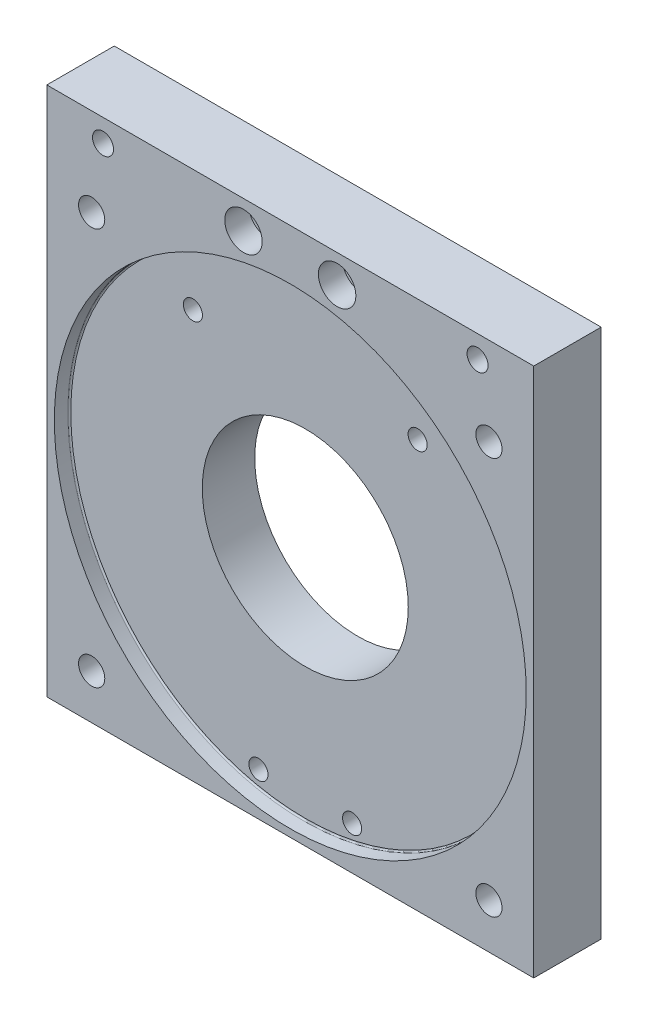
from build123d import *

# Parameters (mm, degrees)
BOSS_EXTRUDE1_DEPTH                                  = 50.8
SKETCH6_W                                            = 7.4
SKETCH6_H                                            = 283
CUT_EXTRUDE3_DEPTH                                   = 306.924238987
SKETCH2_R                                            = 126
CUT_EXTRUDE1_DEPTH                                   = 8
M16_TAPPED_HOLE1_D                                   = 14
SKETCH5_R                                            = 55
CUT_EXTRUDE2_DEPTH                                   = 203.714084365
FILLET1_R                                            = 0.79375
CBORE_FOR_M12_HEX_SOCKET_HEAD_CAP_SCREW1_D           = 13.5
CBORE_FOR_M12_HEX_SOCKET_HEAD_CAP_SCREW1_CBORE_D     = 20
CBORE_FOR_M12_HEX_SOCKET_HEAD_CAP_SCREW1_CBORE_DEPTH = 13
M12_TAPPED_HOLE1_D                                   = 10.2
M6_TAPPED_HOLE1_D                                    = 5
M6_TAPPED_HOLE1_DEPTH                                = 27.99
M6_TAPPED_HOLE1_TIP                                  = 1.502151548
F_11_2_11_2_DIAMETER_HOLE1_D                         = 11.2
F_11_2_11_2_DIAMETER_HOLE1_DEPTH                     = 20
F_11_2_11_2_DIAMETER_HOLE1_TIP                       = 3.364819467


with BuildPart() as part:
    # Sketch1 → Boss-Extrude1 (new body)
    with BuildSketch(Plane.XY):
        Polygon((-130, 130), (-130, -130), (130, -130), (130, 130), (130, 153), (-130, 153), align=None)
    extrude(amount=BOSS_EXTRUDE1_DEPTH)

    # Sketch6 → Cut-Extrude3 (cut, through all)
    with BuildSketch(Plane(origin=(130, 0, 0), x_dir=(0, 0, -1), z_dir=(1, 0, 0))):
        with Locations((-3.7, 11.5)):
            Rectangle(SKETCH6_W, SKETCH6_H)
        with Locations((-47.1, 11.5)):
            Rectangle(SKETCH6_W, SKETCH6_H)
    extrude(amount=-CUT_EXTRUDE3_DEPTH, mode=Mode.SUBTRACT)

    # Sketch2 → Cut-Extrude1 (cut)
    with BuildSketch(Plane.XY.offset(43.4)):
        Circle(SKETCH2_R)
    extrude(amount=-CUT_EXTRUDE1_DEPTH, mode=Mode.SUBTRACT)

    # M16 Tapped Hole1 (through all)
    with Locations(Plane(origin=(116.1053078, 120.483553204, 43.4), x_dir=(1, 0, 0), z_dir=(0, 0, 1))):
        with Locations((-222.171324978, -14.417536026), (-10.039290622, -14.417536026), (-10.039290622, -226.549570382), (-222.171324978, -226.549570382)):
            Hole(M16_TAPPED_HOLE1_D / 2)

    # Sketch5 → Cut-Extrude2 (cut, through all)
    with BuildSketch(Plane.XY.offset(35.4)):
        Circle(SKETCH5_R)
    extrude(amount=-CUT_EXTRUDE2_DEPTH, mode=Mode.SUBTRACT)

    # Fillet1
    fillet1_edges = [part.edges().sort_by_distance(p)[0] for p in [
        (-126, 0, 35.4),
    ]]
    fillet(fillet1_edges, radius=FILLET1_R)

    # CBORE for M12 Hex Socket Head Cap Screw1 (through all)
    with Locations(Plane.XY.offset(43.4)):
        with Locations((-25, 138), (25, 138)):
            CounterBoreHole(CBORE_FOR_M12_HEX_SOCKET_HEAD_CAP_SCREW1_D / 2, CBORE_FOR_M12_HEX_SOCKET_HEAD_CAP_SCREW1_CBORE_D / 2, CBORE_FOR_M12_HEX_SOCKET_HEAD_CAP_SCREW1_CBORE_DEPTH)

    # M12 Tapped Hole1 (through all)
    with Locations(Plane(origin=(0, 0, 7.4), x_dir=(-1, 0, 0), z_dir=(0, 0, -1))):
        with Locations((-60, 80), (60, 80), (25, -115), (-25, -115)):
            Hole(M12_TAPPED_HOLE1_D / 2)

    # M6 Tapped Hole1
    with Locations(Plane(origin=(0, 0, 7.4), x_dir=(-1, 0, 0), z_dir=(0, 0, -1))):
        with Locations((100, 141), (-100, 141)):
            Hole(M6_TAPPED_HOLE1_D / 2, depth=M6_TAPPED_HOLE1_DEPTH)
            with Locations((0, 0, -(M6_TAPPED_HOLE1_DEPTH + M6_TAPPED_HOLE1_TIP / 2))):  # 118° drill point
                Cone(0, M6_TAPPED_HOLE1_D / 2, M6_TAPPED_HOLE1_TIP, mode=Mode.SUBTRACT)

    # Ø11.2 (11.2) Diameter Hole1
    with Locations(Plane.XY.offset(43.4)):
        with Locations((100, 141), (-100, 141)):
            Hole(F_11_2_11_2_DIAMETER_HOLE1_D / 2, depth=F_11_2_11_2_DIAMETER_HOLE1_DEPTH)
            with Locations((0, 0, -(F_11_2_11_2_DIAMETER_HOLE1_DEPTH + F_11_2_11_2_DIAMETER_HOLE1_TIP / 2))):  # 118° drill point
                Cone(0, F_11_2_11_2_DIAMETER_HOLE1_D / 2, F_11_2_11_2_DIAMETER_HOLE1_TIP, mode=Mode.SUBTRACT)


solid = part.part
